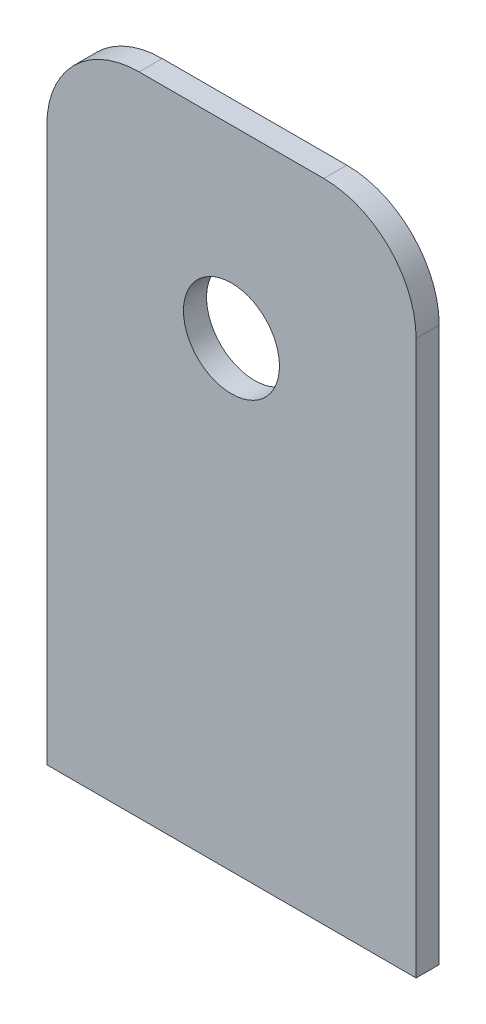
from build123d import *

# Parameters (mm, degrees)
SKETCH1_W               = 25.4
SKETCH1_H               = 31.75
BOSS_EXTRUDE1_DEPTH     = 1.5875
CUT_EXTRUDE1_DEPTH      = 35.232625611
CUT_EXTRUDE1_DEPTH_BACK = 35.232625611
SKETCH2_R               = 3.302
FILLET1_R               = 6.35
SKETCH3_W               = 25.4
SKETCH3_H               = 12.7
BOSS_EXTRUDE2_DEPTH     = 1.5875


with BuildPart() as part:
    # Sketch1 → Boss-Extrude1 (new body)
    with BuildSketch(Plane.XY):
        with Locations((0, 15.875)):
            Rectangle(SKETCH1_W, SKETCH1_H)
    extrude(amount=BOSS_EXTRUDE1_DEPTH)

    # Sketch2 → Cut-Extrude1 (cut, two sides: drawn at the far end of the back side and taken through both)
    with BuildSketch(Plane.XY.offset(1.5875).offset(-CUT_EXTRUDE1_DEPTH_BACK)):
        with Locations((0, 19.05)):
            Circle(SKETCH2_R)
    extrude(amount=CUT_EXTRUDE1_DEPTH + CUT_EXTRUDE1_DEPTH_BACK, mode=Mode.SUBTRACT)

    # Fillet1
    fillet1_edges = [part.edges().sort_by_distance(p)[0] for p in [
        (-12.7, 31.75, 0.79375),
        (12.7, 31.75, 0.79375),
    ]]
    fillet(fillet1_edges, radius=FILLET1_R)

    # Sketch3 → Boss-Extrude2 (add)
    with BuildSketch(Plane(origin=(0, 0, 0), x_dir=(-1, 0, 0), z_dir=(0, 0, -1))):
        with Locations((0, -6.35)):
            Rectangle(SKETCH3_W, SKETCH3_H)
    extrude(amount=-BOSS_EXTRUDE2_DEPTH)


solid = part.part
